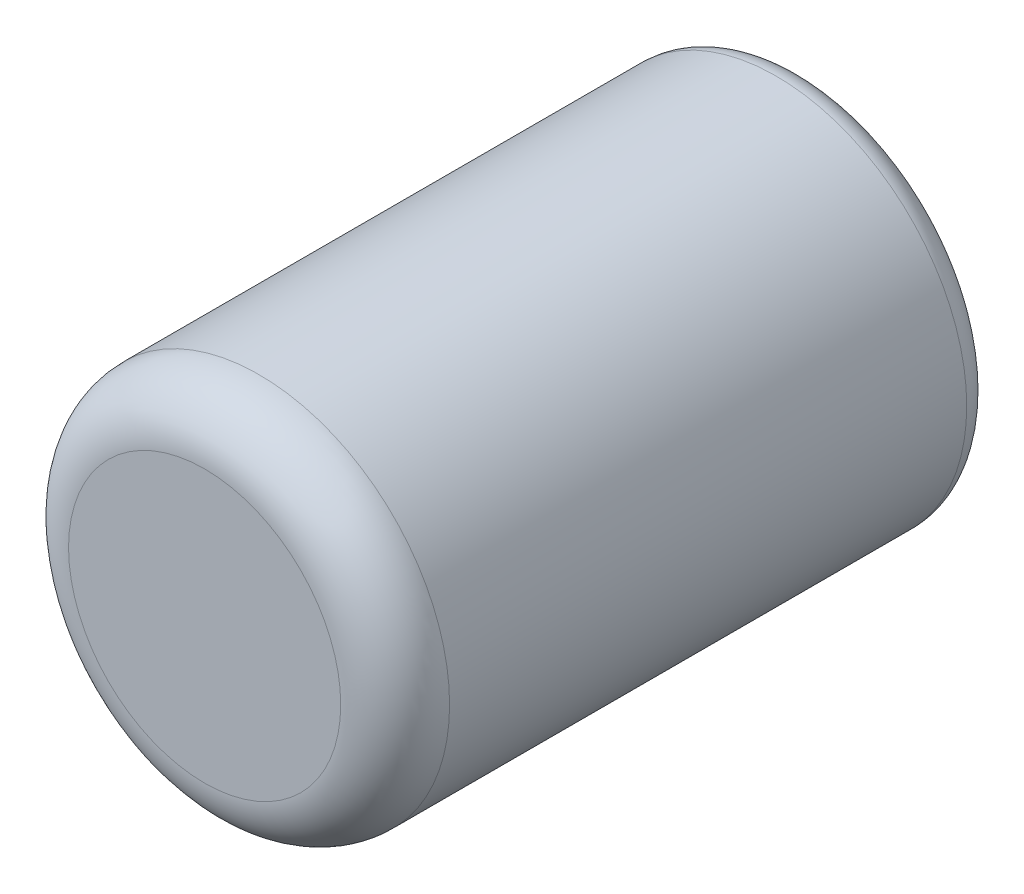
from build123d import *

# Parameters (mm, degrees)
SKETCH1_R           = 7
SKETCH1_R_2         = 4
BOSS_EXTRUDE1_DEPTH = 20
SKETCH2_R           = 7
BOSS_EXTRUDE2_DEPTH = 2
FILLET1_R           = 2
FILLET2_R           = 1


with BuildPart() as part:
    # Sketch1 → Boss-Extrude1 (new body)
    with BuildSketch(Plane.XY):
        Circle(SKETCH1_R)
        Circle(SKETCH1_R_2, mode=Mode.SUBTRACT)
    extrude(amount=BOSS_EXTRUDE1_DEPTH)

    # Sketch2 → Boss-Extrude2 (add)
    with BuildSketch(Plane.XY.offset(20)):
        Circle(SKETCH2_R)
    extrude(amount=BOSS_EXTRUDE2_DEPTH)

    # Fillet1
    fillet1_edges = [part.edges().sort_by_distance(p)[0] for p in [
        (-7, 0, 22),
    ]]
    fillet(fillet1_edges, radius=FILLET1_R)

    # Fillet2
    fillet2_edges = [part.edges().sort_by_distance(p)[0] for p in [
        (-7, 0, 0),
    ]]
    fillet(fillet2_edges, radius=FILLET2_R)


solid = part.part
